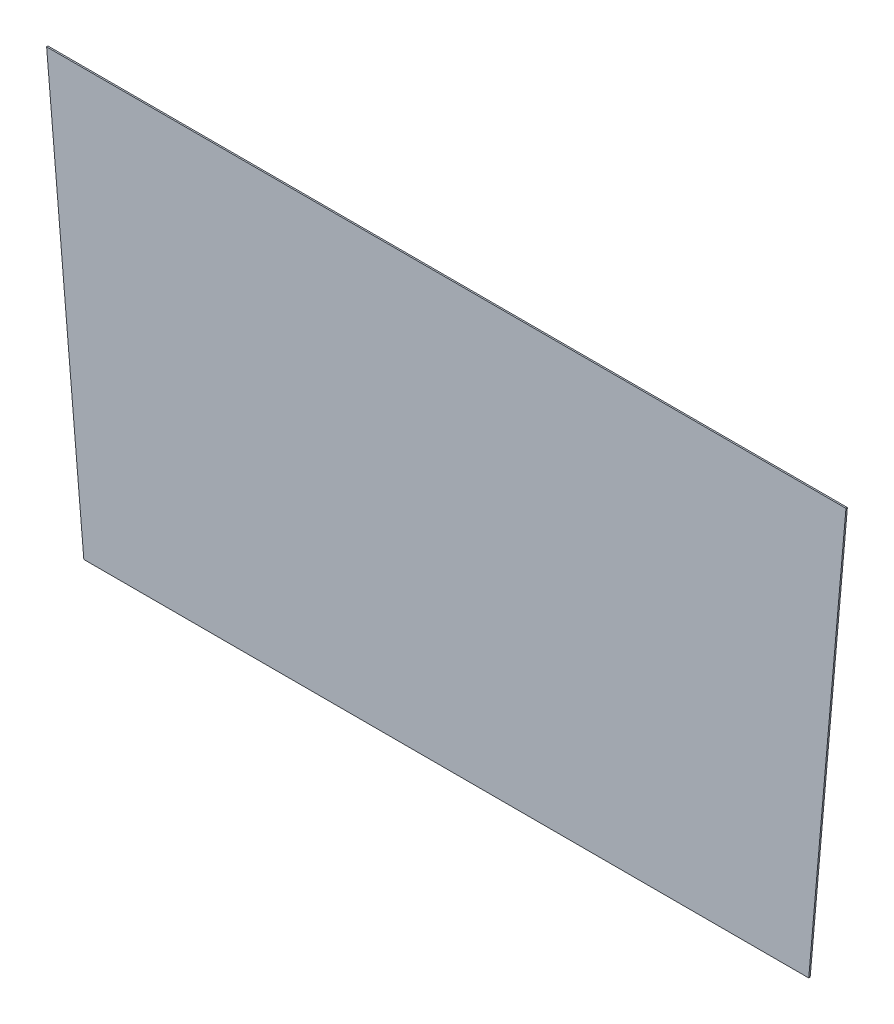
from build123d import *

# Parameters (mm, degrees)
BOSS_EXTRUDE1_DEPTH = 1.5


with BuildPart() as part:
    # Sketch1 → Boss-Extrude1 (new body)
    with BuildSketch(Plane(origin=(4.498873199, 0, 0), x_dir=(1, 0, 0), z_dir=(0, 0, 1))):
        Polygon((-456.825881658, 197.531378845), (385.614286815, 197.531378845), (346.394202579, -250.756235297), (-417.605797421, -250.756235297), align=None)
    extrude(amount=BOSS_EXTRUDE1_DEPTH)


solid = part.part
